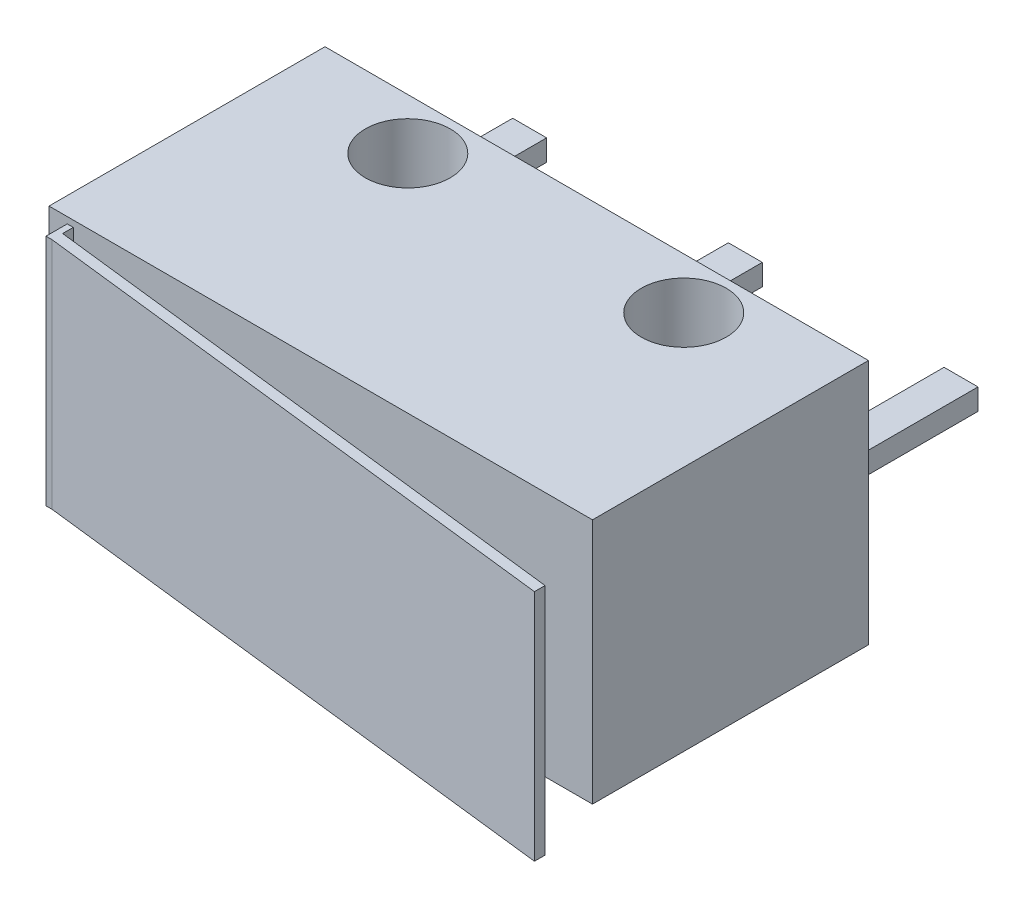
from build123d import *

# Parameters (mm, degrees)
SKETCH_1_W      = 12.8
SKETCH_1_H      = 6.5
SKETCH_1_R      = 1
EXTRUDE_1_DEPTH = 5.8
SKETCH_2_W      = 0.8
SKETCH_2_H      = 0.5
EXTRUDE_2_DEPTH = 3.5
SKETCH_4_W      = 0.142011972
SKETCH_4_H      = 5.5
EXTRUDE_4_DEPTH = 0.5
EXTRUDE_5_DEPTH = 5.5


with BuildPart() as part:
    # 草图1 → 凸台-拉伸1 (new body)
    with BuildSketch(Plane(origin=(0, 0, 0), x_dir=(1, 0, 0), z_dir=(0, 1, 0))):
        Rectangle(SKETCH_1_W, SKETCH_1_H)
        with Locations(Location((-3.25, 2.05, 0), (0, 0, 270))):
            Circle(SKETCH_1_R, mode=Mode.SUBTRACT)
        with Locations(Location((3.25, 2.05, 0), (0, 0, 90))):
            Circle(SKETCH_1_R, mode=Mode.SUBTRACT)
    extrude(amount=EXTRUDE_1_DEPTH)

    # 草图2 → 凸台-拉伸2 (add)
    with BuildSketch(Plane(origin=(0, 0, -3.25), x_dir=(-1, 0, 0), z_dir=(0, 0, -1))):
        with Locations((0, 2.801277115)):
            Rectangle(SKETCH_2_W, SKETCH_2_H)
        with Locations((5.08, 2.801277115)):
            Rectangle(SKETCH_2_W, SKETCH_2_H)
        with Locations((-5.08, 2.801277115)):
            Rectangle(SKETCH_2_W, SKETCH_2_H)
    extrude(amount=EXTRUDE_2_DEPTH)

    # 草图4 → 凸台-拉伸4 (add)
    with BuildSketch(Plane.XY.offset(3.25)):
        with Locations((-5.9, 2.9)):
            Rectangle(SKETCH_4_W, SKETCH_4_H)
    extrude(amount=EXTRUDE_4_DEPTH)

    # 草图6 → 凸台-拉伸5 (add)
    with BuildSketch(Plane.XZ.offset(-0.15)):
        Polygon((-5.828994014, 3.75), (-5.828994014, 3.5), (7.03115002, 4.998700306), (7.03115002, 5.248700306), align=None)
    extrude(amount=-EXTRUDE_5_DEPTH)


solid = part.part
